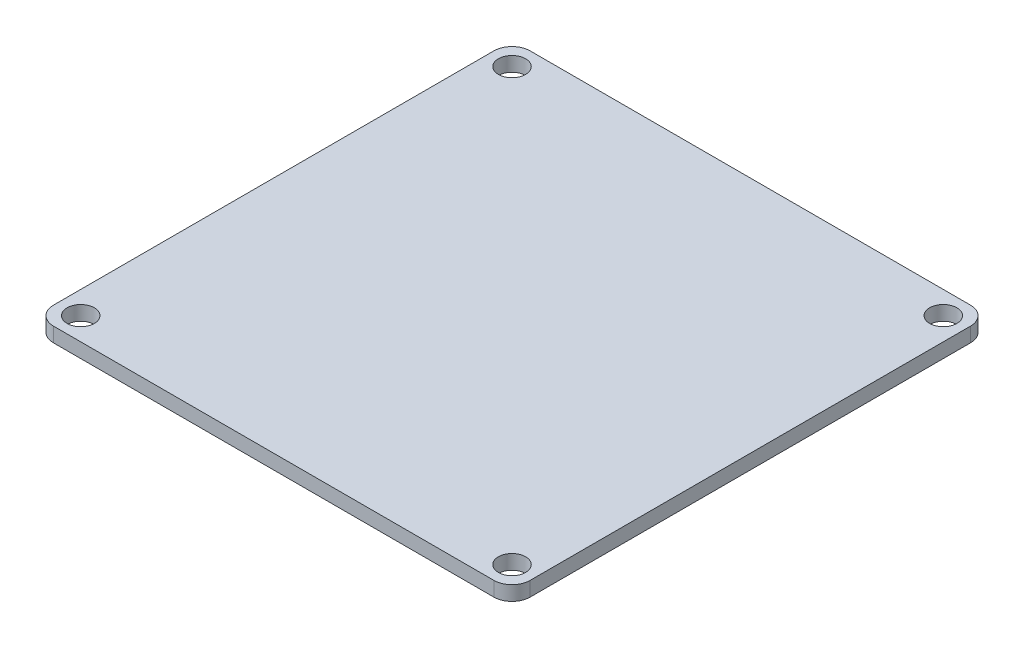
from build123d import *

# Parameters (mm, degrees)
SKETCH1_W           = 52.5
SKETCH1_H           = 52.5
SKETCH1_R           = 1.5
BOSS_EXTRUDE1_DEPTH = 1.6
FILLET1_R           = 2


with BuildPart() as part:
    # Sketch1 → Boss-Extrude1 (new body)
    with BuildSketch(Plane(origin=(0, 0, 0), x_dir=(1, 0, 0), z_dir=(0, 1, 0))):
        Rectangle(SKETCH1_W, SKETCH1_H)
        with Locations(Location((-23.75, 23.75, 0), (0, 0, 270))):
            Circle(SKETCH1_R, mode=Mode.SUBTRACT)
        with Locations(Location((23.75, 23.75, 0), (0, 0, 90))):
            Circle(SKETCH1_R, mode=Mode.SUBTRACT)
        with Locations(Location((23.75, -23.75, 0), (0, 0, 270))):
            Circle(SKETCH1_R, mode=Mode.SUBTRACT)
        with Locations(Location((-23.75, -23.75, 0), (0, 0, 90))):
            Circle(SKETCH1_R, mode=Mode.SUBTRACT)
    extrude(amount=BOSS_EXTRUDE1_DEPTH)

    # Fillet1
    fillet1_edges = [part.edges().sort_by_distance(p)[0] for p in [
        (26.25, 0.8, -26.25),
        (26.25, 0.8, 26.25),
        (-26.25, 0.8, 26.25),
        (-26.25, 0.8, -26.25),
    ]]
    fillet(fillet1_edges, radius=FILLET1_R)


solid = part.part
